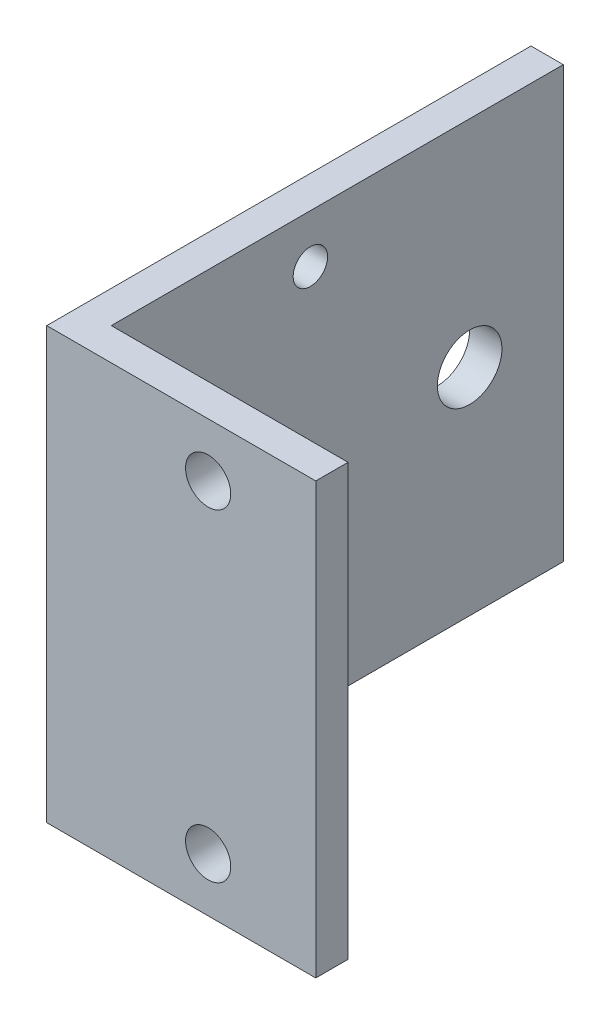
from build123d import *

# Parameters (mm, degrees)
SKETCH_1_W                  = 40
SKETCH_1_H                  = 45
EXTRUDE_1_DEPTH             = 25
SKETCH_2_W                  = 22
SKETCH_2_H                  = 50
CUT_EXTRUDE_1_DEPTH         = 90.827612681
SKETCH_3_R                  = 3
CUT_EXTRUDE_2_DEPTH         = 227.991189256
HOLE_WIZARD_4_2_4_2_1_D     = 4.2
HOLE_WIZARD_3_2_3_2_1_D     = 3.2
HOLE_WIZARD_3_2_3_2_1_DEPTH = 25


with BuildPart() as part:
    # 草图1 → 凸台-拉伸1 (new body)
    with BuildSketch(Plane(origin=(-63, 0, 0), x_dir=(0, -1, 0), z_dir=(-1, 0, 0))):
        with Locations((-200, -27.5)):
            Rectangle(SKETCH_1_W, SKETCH_1_H)
    extrude(amount=-EXTRUDE_1_DEPTH)

    # 草图2 → 切除-拉伸1 (cut, through all)
    with BuildSketch(Plane(origin=(0, 220, 0), x_dir=(-1, 0, 0), z_dir=(0, 1, 0))):
        with Locations((49, -33)):
            Rectangle(SKETCH_2_W, SKETCH_2_H)
    extrude(amount=-CUT_EXTRUDE_1_DEPTH, mode=Mode.SUBTRACT)

    # 草图3 → 切除-拉伸2 (cut, through all)
    with BuildSketch(Plane.ZY.offset(63)):
        with Locations(Location((-41.3, 200, 0), (0, 0, 270))):
            Circle(SKETCH_3_R)
    extrude(amount=-CUT_EXTRUDE_2_DEPTH, mode=Mode.SUBTRACT)

    # Ø4.2 (4.2) 直径孔1 (through all)
    with Locations(Plane(origin=(0, 0, -8), x_dir=(-1, 0, 0), z_dir=(0, 0, -1))):
        with Locations((48, 215), (48, 185)):
            Hole(HOLE_WIZARD_4_2_4_2_1_D / 2)

    # Ø3.2 (3.2) 直径孔1
    with Locations(Plane.ZY.offset(63)):
        with Locations((-26.5, 215.5), (-26.5, 184.5), (-13.076606241, 207.75), (-13.076606241, 192.25)):
            Hole(HOLE_WIZARD_3_2_3_2_1_D / 2, depth=HOLE_WIZARD_3_2_3_2_1_DEPTH)


solid = part.part
